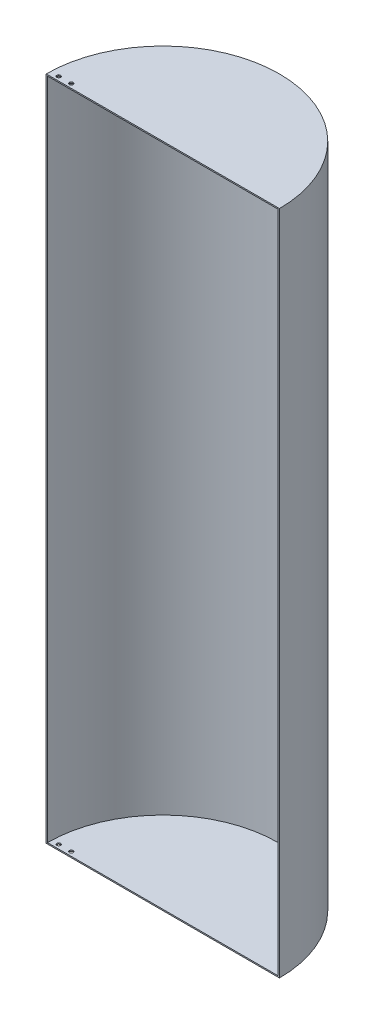
from build123d import *

# Parameters (mm, degrees)
BOSS_EXTRUDE1_DEPTH            = 800
SHELL1_T                       = -1.5
M4_CLEARANCE_HOLE1_D           = 4.5
M4_CLEARANCE_HOLE1_CSINK_D     = 4.55
M4_CLEARANCE_HOLE1_CSINK_ANGLE = 100


with BuildPart() as part:
    # Sketch1 → Boss-Extrude1 (new body)
    with BuildSketch(Plane(origin=(0, 0, 0), x_dir=(1, 0, 0), z_dir=(0, 1, 0))):
        with BuildLine():
            Line((-140, 0), (140, 0))
            ThreePointArc((140, 0), (0, 140), (-140, 0))
        make_face()
    extrude(amount=BOSS_EXTRUDE1_DEPTH)

    # Shell1
    shell1_openings = [part.faces().sort_by_distance(p)[0] for p in [
        (0, 400, 0),
    ]]
    offset(amount=SHELL1_T, openings=shell1_openings)

    # M4 Clearance Hole1 (through all)
    with Locations(Plane(origin=(0, 800, 0), x_dir=(1, 0, 0), z_dir=(0, 1, 0))):
        with Locations((-130, 5), (-115, 5)):
            CounterSinkHole(M4_CLEARANCE_HOLE1_D / 2, M4_CLEARANCE_HOLE1_CSINK_D / 2, counter_sink_angle=M4_CLEARANCE_HOLE1_CSINK_ANGLE)


solid = part.part
